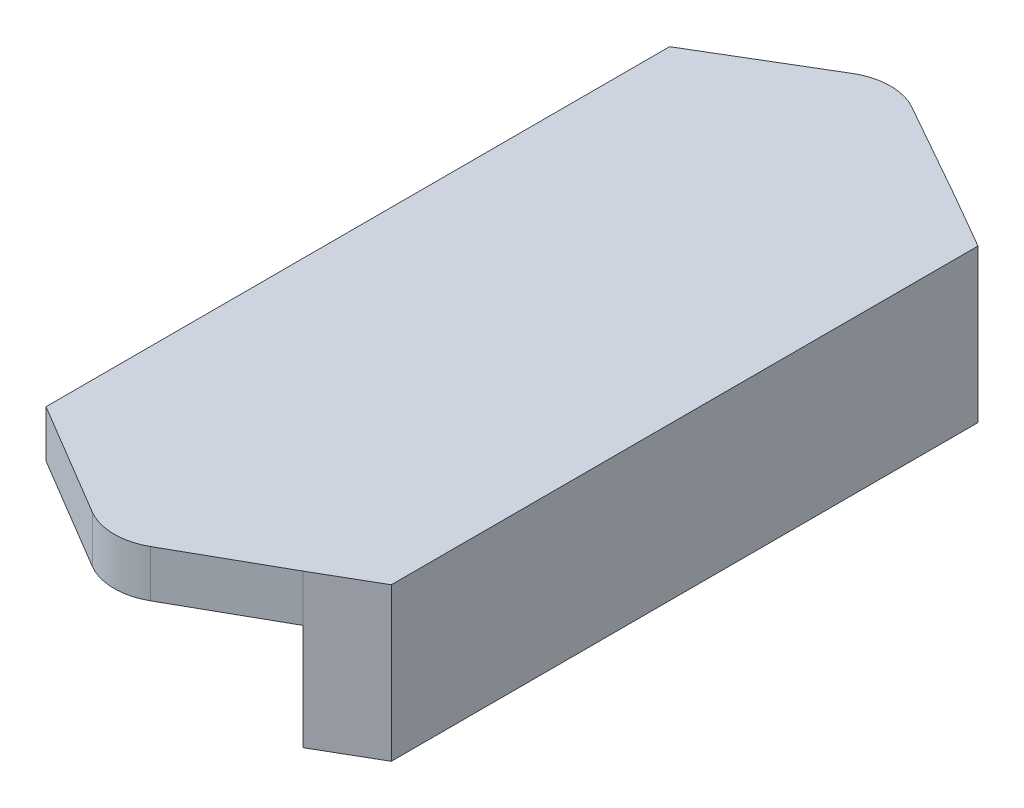
from build123d import *

# Parameters (mm, degrees)
SKETCH_1_W          = 60
SKETCH_1_H          = 62
EXTRUDE_1_DEPTH     = 9
CUT_EXTRUDE_1_DEPTH = 20
SKETCH_3_R          = 5
EXTRUDE_2_DEPTH     = 4


with BuildPart() as part:
    # 草图1 → 凸台-拉伸1 (new body)
    with BuildSketch(Plane(origin=(0, 0, 0), x_dir=(1, 0, 0), z_dir=(0, 1, 0))):
        Rectangle(SKETCH_1_W, SKETCH_1_H)
    extrude(amount=EXTRUDE_1_DEPTH)

    # 草图2 → 切除-拉伸1 (cut)
    with BuildSketch(Plane.XZ):
        Polygon((6.215250205, 4), (25.8, 4), (28.7, 15.937822174), (23.906181585, 25.383019067), (25.236860279, 27.687822174), (30, 24.937822174), (30, 31), (-30, 31), (-30, -31), (30, -31), (30, -24.937822174), (25.236860279, -27.687822174), (23.906181585, -25.383019067), (28.7, -15.937822174), (25.8, -4), (6.215250205, -4), (3.715250205, -7.102951113), (2.215250205, -7.102951113), (2.215250205, 0), (2.215250205, 7.102951113), (3.715250205, 7.102951113), align=None)
    extrude(amount=-CUT_EXTRUDE_1_DEPTH, mode=Mode.SUBTRACT)

    # 草图3 → 凸台-拉伸2 (add)
    with BuildSketch(Plane(origin=(0, 9, 0), x_dir=(1, 0, 0), z_dir=(0, 1, 0))):
        Polygon((2.215250205, 0), (30, 0), (30, 24.937822174), (25.236860279, 27.687822174), (23.906181585, 25.383019067), (28.7, 15.937822174), (25.8, 4), (6.215250205, 4), (3.715250205, 7.102951113), (2.215250205, 7.102951113), align=None)
        with BuildLine():
            Line((23.906181585, 25.383019067), (25.236860279, 27.687822174))
            Line((25.236860279, 27.687822174), (16.955072532, 32.35575698))
            ThreePointArc((16.955072532, 32.35575698), (18.817138095, 30.522363707), (19.5, 28))
            ThreePointArc((19.5, 28), (12.029027225, 23.65324333), (11.942282582, 32.296286956))
            Line((11.942282582, 32.296286956), (2.215250205, 26.50547261))
            Line((2.215250205, 26.50547261), (2.215250205, 7.102951113))
            Line((2.215250205, 7.102951113), (3.715250205, 7.102951113))
            Line((3.715250205, 7.102951113), (6.215250205, 4))
            Line((6.215250205, 4), (25.8, 4))
            Line((25.8, 4), (28.7, 15.937822174))
            Line((28.7, 15.937822174), (23.906181585, 25.383019067))
        make_face()
        with Locations((14.5, 28)):
            Circle(SKETCH_3_R)
        Polygon((25.236860279, -27.687822174), (30, -24.937822174), (30, 0), (2.215250205, 0), (2.215250205, -7.102951113), (3.715250205, -7.102951113), (6.215250205, -4), (25.8, -4), (28.7, -15.937822174), (23.906181585, -25.383019067), align=None)
        with BuildLine():
            Line((16.955072532, -32.35575698), (25.236860279, -27.687822174))
            Line((25.236860279, -27.687822174), (23.906181585, -25.383019067))
            Line((23.906181585, -25.383019067), (28.7, -15.937822174))
            Line((28.7, -15.937822174), (25.8, -4))
            Line((25.8, -4), (6.215250205, -4))
            Line((6.215250205, -4), (3.715250205, -7.102951113))
            Line((3.715250205, -7.102951113), (2.215250205, -7.102951113))
            Line((2.215250205, -7.102951113), (2.215250205, -26.50547261))
            Line((2.215250205, -26.50547261), (11.942282582, -32.296286956))
            ThreePointArc((11.942282582, -32.296286956), (12.029027225, -23.65324333), (19.5, -28))
            ThreePointArc((19.5, -28), (18.817138095, -30.522363707), (16.955072532, -32.35575698))
        make_face()
        with Locations((14.5, -28)):
            Circle(SKETCH_3_R)
    extrude(amount=EXTRUDE_2_DEPTH)


solid = part.part
